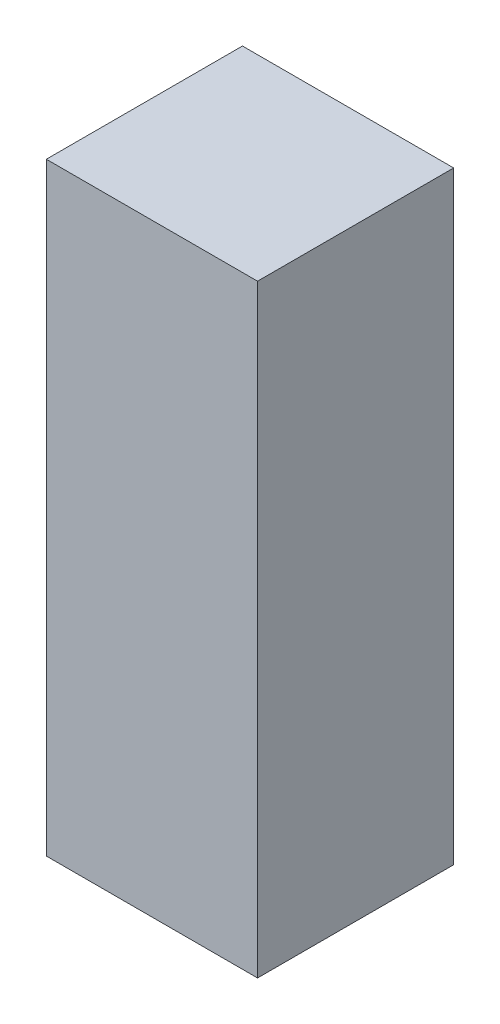
from build123d import *

# Parameters (mm, degrees)
PRESS_KOVA_KAPAGI_MENTESE_1_1_START = 20
SKETCH1_W                           = 14
SKETCH1_H                           = 40
PRESS_KOVA_KAPAGI_MENTESE_1_1_DEPTH = 13


with BuildPart() as part:
    # Sketch1 → PRESS_kova_kapagi_mentese_1_1 (new body)
    with BuildSketch(Plane.XY.offset(PRESS_KOVA_KAPAGI_MENTESE_1_1_START)):
        with Locations((31, 1400)):
            Rectangle(SKETCH1_W, SKETCH1_H)
    extrude(amount=PRESS_KOVA_KAPAGI_MENTESE_1_1_DEPTH)


solid = part.part
